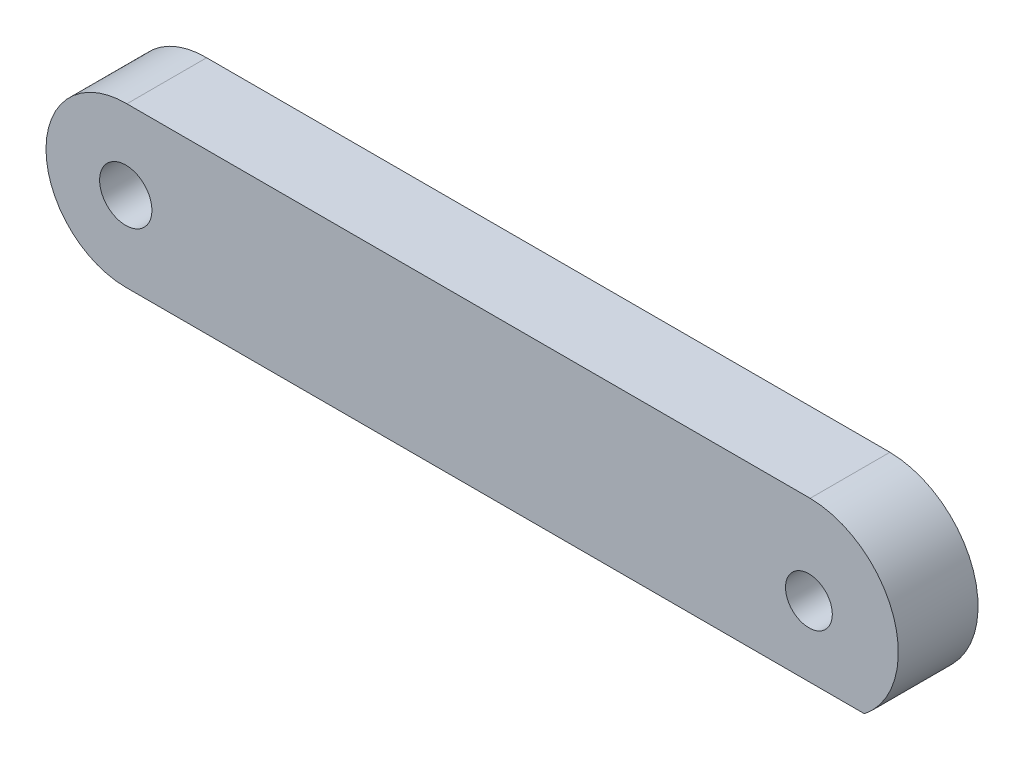
from build123d import *

# Parameters (mm, degrees)
SKETCH1_R           = 0.9316
SKETCH1_R_2         = 1.0414
BOSS_EXTRUDE1_DEPTH = 3.175


with BuildPart() as part:
    # Sketch1 → Boss-Extrude1 (new body)
    with BuildSketch(Plane.XY.offset(57.787763362)):
        with BuildLine():
            Line((-62.816186274, 16.109942792), (-90.02052276, 16.109942792))
            ThreePointArc((-90.02052276, 16.109942792), (-93.240385314, 12.957732487), (-90.065464838, 9.760260885))
            Line((-90.065464838, 9.760260885), (-60.655185343, 9.760260885))
            ThreePointArc((-60.655185343, 9.760260885), (-59.496336577, 13.69722439), (-62.816186274, 16.109942792))
        make_face()
        with Locations((-62.866579111, 12.550222483)):
            Circle(SKETCH1_R, mode=Mode.SUBTRACT)
        with Locations((-90.065464838, 12.935260885)):
            Circle(SKETCH1_R_2, mode=Mode.SUBTRACT)
    extrude(amount=BOSS_EXTRUDE1_DEPTH)


solid = part.part
